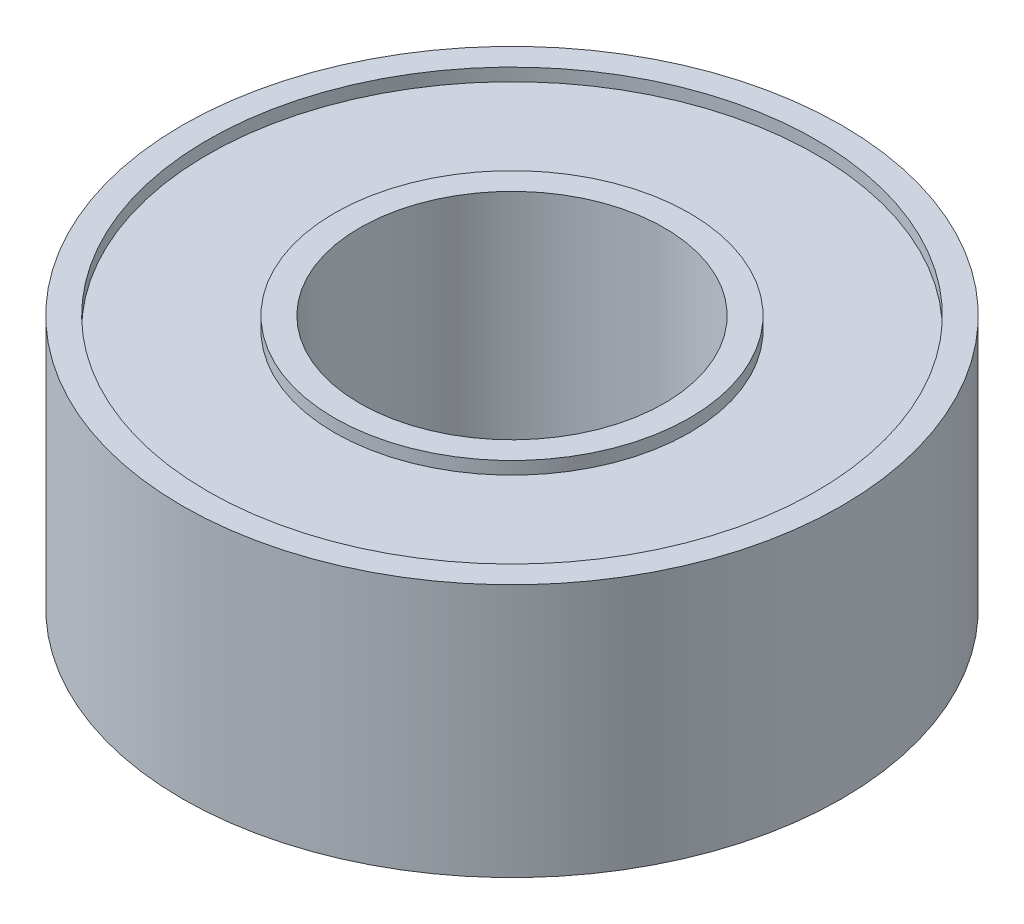
from build123d import *

# Parameters (mm, degrees)
SKETCH1_R           = 6.5
SKETCH1_R_2         = 3
BOSS_EXTRUDE1_DEPTH = 5
SKETCH2_W           = 2.5
SKETCH2_H           = 0.25


with BuildPart() as part:
    # Sketch1 → Boss-Extrude1 (new body)
    with BuildSketch(Plane(origin=(0, 0, 0), x_dir=(1, 0, 0), z_dir=(0, 1, 0))):
        with Locations(Location((0, 0, 0), (0, 0, 270))):
            Circle(SKETCH1_R)
        with Locations(Location((0, 0, 0), (0, 0, 270))):
            Circle(SKETCH1_R_2, mode=Mode.SUBTRACT)
    extrude(amount=BOSS_EXTRUDE1_DEPTH)

    # Sketch2 → Cut-Revolve1 (revolve, cut)
    with BuildSketch(Plane.XY, mode=Mode.PRIVATE) as cut_revolve1_sk:
        with Locations((-4.75, 4.875)):
            Rectangle(SKETCH2_W, SKETCH2_H)
        with Locations((-4.75, 0.125)):
            Rectangle(SKETCH2_W, SKETCH2_H)
    revolve(cut_revolve1_sk.sketch.rotate(Axis((0, 5, 0), (0, -1, 0)), 270), axis=Axis((0, 5, 0), (0, -1, 0)), mode=Mode.SUBTRACT)


solid = part.part
